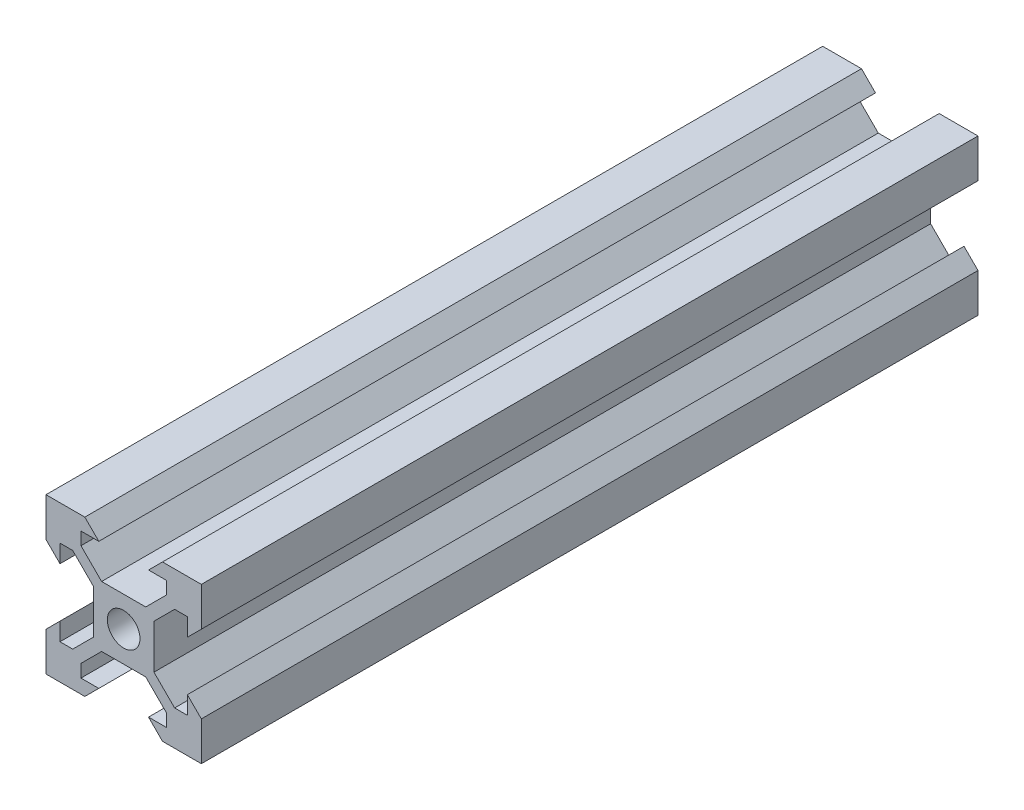
from build123d import *

# Parameters (mm, degrees)
SKETCH1_R           = 2.1
BOSS_EXTRUDE1_DEPTH = 500
SKETCH_1_W          = 27.905772362
SKETCH_1_H          = 25.676840262
CUT_EXTRUDE_1_DEPTH = 400


with BuildPart() as part:
    # Sketch1 → Boss-Extrude1 (new body)
    with BuildSketch(Plane.XY):
        Polygon((-10, 10), (-10, 5), (-8.2, 3.2), (-8.2, 5.499339828), (-6.56, 5.499339828), (-3.900660172, 2.84), (-3.900660172, -2.84), (-6.56, -5.499339828), (-8.2, -5.499339828), (-8.2, -3.2), (-10, -5), (-10, -10), (-5, -10), (-3.2, -8.2), (-5.499339828, -8.2), (-5.499339828, -6.56), (-2.84, -3.900660172), (2.84, -3.900660172), (5.499339828, -6.56), (5.499339828, -8.2), (3.2, -8.2), (5, -10), (10, -10), (10, -5), (8.2, -3.2), (8.2, -5.499339828), (6.56, -5.499339828), (3.900660172, -2.84), (3.900660172, 2.84), (6.56, 5.499339828), (8.2, 5.499339828), (8.2, 3.2), (10, 5), (10, 10), (5, 10), (3.2, 8.2), (5.499339828, 8.2), (5.499339828, 6.56), (2.84, 3.900660172), (-2.84, 3.900660172), (-5.499339828, 6.56), (-5.499339828, 8.2), (-3.2, 8.2), (-5, 10), align=None)
        Circle(SKETCH1_R, mode=Mode.SUBTRACT)
    extrude(amount=-BOSS_EXTRUDE1_DEPTH)

    # 草图1 → 切除-拉伸1 (cut)
    with BuildSketch(Plane.XY):
        Rectangle(SKETCH_1_W, SKETCH_1_H)
    extrude(amount=-CUT_EXTRUDE_1_DEPTH, mode=Mode.SUBTRACT)


solid = part.part
